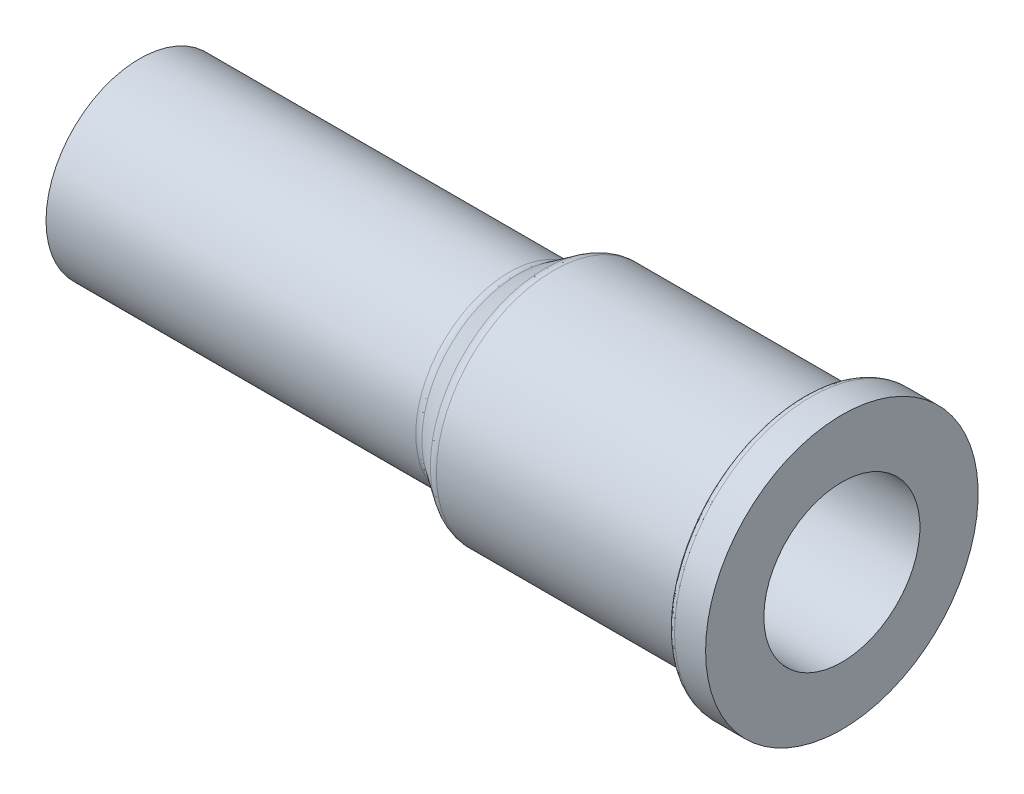
from build123d import *

# Parameters (mm, degrees)
FILLET_2_R = 0.5
FILLET_3_R = 0.5
FILLET_4_R = 1
FILLET_5_R = 1


with BuildPart() as part:
    # 草图2 → 旋转1 (revolve)
    with BuildSketch(Plane.XY, mode=Mode.PRIVATE) as revolve_1_sk:
        Polygon((-32.84202412, 5), (12.15797588, 5), (12.15797588, 7.5), (12.15797588, 8.732933377), (9.81519701, 8.732933377), (9.36644596, 7.5), (-6.63355404, 7.5), (-8.84202412, 6), (-32.84202412, 6), align=None)
    revolve(revolve_1_sk.sketch.rotate(Axis((-59.135771609, 0, 0), (1, 0, 0)), 90), axis=Axis((-59.135771609, 0, 0), (1, 0, 0)))

    # 圆角2
    fillet_2_edges = [part.edges().sort_by_distance(p)[0] for p in [
        (9.36644596, 0, -7.5),
    ]]
    fillet(fillet_2_edges, radius=FILLET_2_R)

    # 圆角3
    fillet_3_edges = [part.edges().sort_by_distance(p)[0] for p in [
        (9.81519701, 0, -8.732933377),
    ]]
    fillet(fillet_3_edges, radius=FILLET_3_R)

    # 圆角4
    fillet_4_edges = [part.edges().sort_by_distance(p)[0] for p in [
        (-6.63355404, 0, -7.5),
    ]]
    fillet(fillet_4_edges, radius=FILLET_4_R)

    # 圆角5
    fillet_5_edges = [part.edges().sort_by_distance(p)[0] for p in [
        (-8.84202412, 0, -6),
    ]]
    fillet(fillet_5_edges, radius=FILLET_5_R)


solid = part.part
